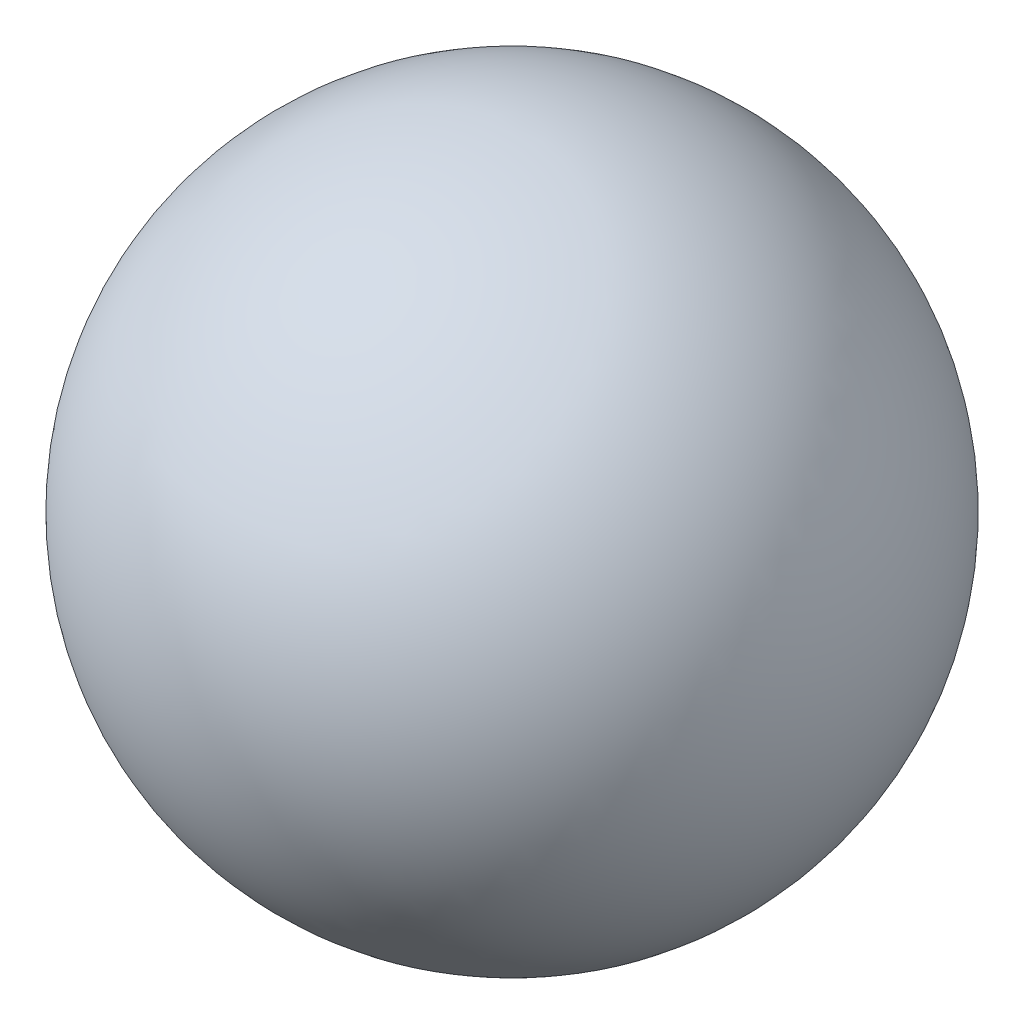
from build123d import *


with BuildPart() as part:
    # Sketch1 → Revolve2 (revolve)
    with BuildSketch(Plane.XY):
        with BuildLine():
            Line((0, 32.5), (0, -32.5))
            ThreePointArc((0, -32.5), (32.5, 0), (0, 32.5))
        make_face()
    revolve(axis=Axis((0, 32.5, 0), (0, -1, 0)))


solid = part.part
